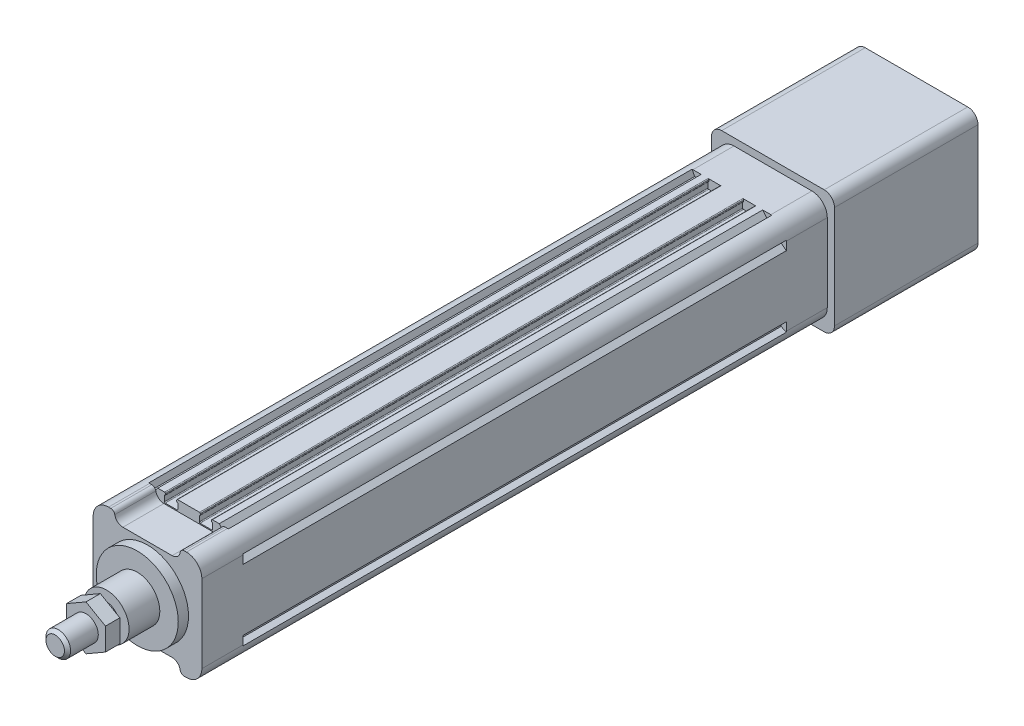
from build123d import *

# Parameters (mm, degrees)
SKETCH_1_R             = 2.1
EXTRUDE_1_DEPTH        = 265
EXTRUDE_2_DEPTH        = 20
SKETCH_7_R             = 20
EXTRUDE_3_DEPTH        = 5
SKETCH_9_R             = 11
EXTRUDE_4_DEPTH        = 15
SKETCH_10_R            = 6
EXTRUDE_5_DEPTH        = 25
EXTRUDE_START          = 20
EXTRUDE_6_DEPTH        = 20
EXTRUDE_7_DEPTH        = 70
SKETCH_14_R            = 19
CUT_EXTRUDE_2_DEPTH    = 70
HOLE_WIZARD_M6_1_D     = 5
HOLE_WIZARD_M6_1_DEPTH = 15
HOLE_WIZARD_M6_1_TIP   = 1.502151548
CHAMFER_1_SIZE         = 1.5
EXTRUDE_START_2        = 3
EXTRUDE_8_DEPTH        = 7


with BuildPart() as part:
    # 草图1 → 凸台-拉伸1 (new body)
    with BuildSketch(Plane.XY):
        with BuildLine():
            Line((-18.2, 24), (-19.443439638, 26.486879276))
            ThreePointArc((-19.443439638, 26.486879276), (-24.303300859, 24.303300859), (-26.486879276, 19.443439638))
            Line((-26.486879276, 19.443439638), (-24, 18.2))
            Line((-24, 18.2), (-24, 17.1))
            Line((-24, 17.1), (-26.5, 15))
            Line((-26.5, 15), (-26.5, -15))
            Line((-26.5, -15), (-24, -17.1))
            Line((-24, -17.1), (-24, -18.2))
            Line((-24, -18.2), (-26.486879276, -19.443439638))
            ThreePointArc((-26.486879276, -19.443439638), (-24.303300859, -24.303300859), (-19.443439638, -26.486879276))
            Line((-19.443439638, -26.486879276), (-18.2, -24))
            Line((-18.2, -24), (-17.1, -24))
            Line((-17.1, -24), (-15, -26.5))
            Line((-15, -26.5), (-11.65, -26.5))
            ThreePointArc((-11.65, -26.5), (-11.367157288, -26.382842712), (-11.25, -26.1))
            Line((-11.25, -26.1), (-11.25, -25.6))
            ThreePointArc((-11.25, -25.6), (-11.367157288, -25.317157288), (-11.65, -25.2))
            Line((-11.65, -25.2), (-11.75, -25.2))
            Line((-11.75, -25.2), (-11.75, -22.4))
            ThreePointArc((-11.75, -22.4), (-11.632842712, -22.117157288), (-11.35, -22))
            Line((-11.35, -22), (-5.65, -22))
            ThreePointArc((-5.65, -22), (-5.367157288, -22.117157288), (-5.25, -22.4))
            Line((-5.25, -22.4), (-5.25, -25.2))
            Line((-5.25, -25.2), (-5.35, -25.2))
            ThreePointArc((-5.35, -25.2), (-5.632842712, -25.317157288), (-5.75, -25.6))
            Line((-5.75, -25.6), (-5.75, -26.1))
            ThreePointArc((-5.75, -26.1), (-5.632842712, -26.382842712), (-5.35, -26.5))
            Line((-5.35, -26.5), (5.35, -26.5))
            ThreePointArc((5.35, -26.5), (5.632842712, -26.382842712), (5.75, -26.1))
            Line((5.75, -26.1), (5.75, -25.6))
            ThreePointArc((5.75, -25.6), (5.632842712, -25.317157288), (5.35, -25.2))
            Line((5.35, -25.2), (5.25, -25.2))
            Line((5.25, -25.2), (5.25, -22.4))
            ThreePointArc((5.25, -22.4), (5.367157288, -22.117157288), (5.65, -22))
            Line((5.65, -22), (11.35, -22))
            ThreePointArc((11.35, -22), (11.632842712, -22.117157288), (11.75, -22.4))
            Line((11.75, -22.4), (11.75, -25.2))
            Line((11.75, -25.2), (11.65, -25.2))
            ThreePointArc((11.65, -25.2), (11.367157288, -25.317157288), (11.25, -25.6))
            Line((11.25, -25.6), (11.25, -26.1))
            ThreePointArc((11.25, -26.1), (11.367157288, -26.382842712), (11.65, -26.5))
            Line((11.65, -26.5), (15, -26.5))
            Line((15, -26.5), (17.1, -24))
            Line((17.1, -24), (18.2, -24))
            Line((18.2, -24), (19.443439638, -26.486879276))
            ThreePointArc((19.443439638, -26.486879276), (24.303300859, -24.303300859), (26.486879276, -19.443439638))
            Line((26.486879276, -19.443439638), (24, -18.2))
            Line((24, -18.2), (24, -17.1))
            Line((24, -17.1), (26.5, -15))
            Line((26.5, -15), (26.5, 15))
            Line((26.5, 15), (24, 17.1))
            Line((24, 17.1), (24, 18.2))
            Line((24, 18.2), (26.486879276, 19.443439638))
            ThreePointArc((26.486879276, 19.443439638), (24.303300859, 24.303300859), (19.443439638, 26.486879276))
            Line((19.443439638, 26.486879276), (18.2, 24))
            Line((18.2, 24), (17.1, 24))
            Line((17.1, 24), (15, 26.5))
            Line((15, 26.5), (11.65, 26.5))
            ThreePointArc((11.65, 26.5), (11.367157288, 26.382842712), (11.25, 26.1))
            Line((11.25, 26.1), (11.25, 25.6))
            ThreePointArc((11.25, 25.6), (11.367157288, 25.317157288), (11.65, 25.2))
            Line((11.65, 25.2), (11.75, 25.2))
            Line((11.75, 25.2), (11.75, 22.4))
            ThreePointArc((11.75, 22.4), (11.632842712, 22.117157288), (11.35, 22))
            Line((11.35, 22), (5.65, 22))
            ThreePointArc((5.65, 22), (5.367157288, 22.117157288), (5.25, 22.4))
            Line((5.25, 22.4), (5.25, 25.2))
            Line((5.25, 25.2), (5.35, 25.2))
            ThreePointArc((5.35, 25.2), (5.632842712, 25.317157288), (5.75, 25.6))
            Line((5.75, 25.6), (5.75, 26.1))
            ThreePointArc((5.75, 26.1), (5.632842712, 26.382842712), (5.35, 26.5))
            Line((5.35, 26.5), (-5.35, 26.5))
            ThreePointArc((-5.35, 26.5), (-5.632842712, 26.382842712), (-5.75, 26.1))
            Line((-5.75, 26.1), (-5.75, 25.6))
            ThreePointArc((-5.75, 25.6), (-5.632842712, 25.317157288), (-5.35, 25.2))
            Line((-5.35, 25.2), (-5.25, 25.2))
            Line((-5.25, 25.2), (-5.25, 22.4))
            ThreePointArc((-5.25, 22.4), (-5.367157288, 22.117157288), (-5.65, 22))
            Line((-5.65, 22), (-11.35, 22))
            ThreePointArc((-11.35, 22), (-11.632842712, 22.117157288), (-11.75, 22.4))
            Line((-11.75, 22.4), (-11.75, 25.2))
            Line((-11.75, 25.2), (-11.65, 25.2))
            ThreePointArc((-11.65, 25.2), (-11.367157288, 25.317157288), (-11.25, 25.6))
            Line((-11.25, 25.6), (-11.25, 26.1))
            ThreePointArc((-11.25, 26.1), (-11.367157288, 26.382842712), (-11.65, 26.5))
            Line((-11.65, 26.5), (-15, 26.5))
            Line((-15, 26.5), (-17.1, 24))
            Line((-17.1, 24), (-18.2, 24))
        make_face()
        with Locations((19, 19)):
            Circle(SKETCH_1_R, mode=Mode.SUBTRACT)
        with Locations((19, -19)):
            Circle(SKETCH_1_R, mode=Mode.SUBTRACT)
        with Locations((-19, -19)):
            Circle(SKETCH_1_R, mode=Mode.SUBTRACT)
        with Locations((-19, 19)):
            Circle(SKETCH_1_R, mode=Mode.SUBTRACT)
        with BuildLine():
            Line((19.773719933, 3), (23.3, 3))
            Line((23.3, 3), (23.3, -3))
            Line((23.3, -3), (19.773719933, -3))
            ThreePointArc((19.773719933, -3), (0, -20), (-19.773719933, -3))
            Line((-19.773719933, -3), (-23.3, -3))
            Line((-23.3, -3), (-23.3, 3))
            Line((-23.3, 3), (-19.773719933, 3))
            ThreePointArc((-19.773719933, 3), (0, 20), (19.773719933, 3))
        make_face(mode=Mode.SUBTRACT)
    extrude(amount=EXTRUDE_1_DEPTH)

    # 草图6 → 凸台-拉伸2 (add)
    with BuildSketch(Plane.XY.offset(265)):
        with BuildLine():
            Line((-26.5, -19), (-26.5, 19))
            ThreePointArc((-26.5, 19), (-24.303300859, 24.303300859), (-19, 26.5))
            Line((-19, 26.5), (-17.916079783, 26.5))
            ThreePointArc((-17.916079783, 26.5), (-16.625085334, 26.027525232), (-15.944053189, 24.833333333))
            ThreePointArc((-15.944053189, 24.833333333), (-14.581988897, 22.444949537), (-12, 21.5))
            Line((-12, 21.5), (12, 21.5))
            ThreePointArc((12, 21.5), (14.581988897, 22.444949537), (15.944053189, 24.833333333))
            ThreePointArc((15.944053189, 24.833333333), (16.625085334, 26.027525232), (17.916079783, 26.5))
            Line((17.916079783, 26.5), (19, 26.5))
            ThreePointArc((19, 26.5), (24.303300859, 24.303300859), (26.5, 19))
            Line((26.5, 19), (26.5, -19))
            ThreePointArc((26.5, -19), (24.303300859, -24.303300859), (19, -26.5))
            Line((19, -26.5), (17.916079783, -26.5))
            ThreePointArc((17.916079783, -26.5), (16.625085334, -26.027525232), (15.944053189, -24.833333333))
            ThreePointArc((15.944053189, -24.833333333), (14.581988897, -22.444949537), (12, -21.5))
            Line((12, -21.5), (-12, -21.5))
            ThreePointArc((-12, -21.5), (-14.581988897, -22.444949537), (-15.944053189, -24.833333333))
            ThreePointArc((-15.944053189, -24.833333333), (-16.625085334, -26.027525232), (-17.916079783, -26.5))
            Line((-17.916079783, -26.5), (-19, -26.5))
            ThreePointArc((-19, -26.5), (-24.303300859, -24.303300859), (-26.5, -19))
        make_face()
    extrude(amount=EXTRUDE_2_DEPTH)

    # 草图7 → 凸台-拉伸3 (add)
    with BuildSketch(Plane.XY.offset(285)):
        Circle(SKETCH_7_R)
    extrude(amount=EXTRUDE_3_DEPTH)

    # 草图9 → 凸台-拉伸4 (add)
    with BuildSketch(Plane.XY.offset(290)):
        Circle(SKETCH_9_R)
    extrude(amount=EXTRUDE_4_DEPTH)

    # 草图10 → 凸台-拉伸5 (add)
    with BuildSketch(Plane.XY.offset(305)):
        Circle(SKETCH_10_R)
    extrude(amount=EXTRUDE_5_DEPTH)

    # 草图11 → 凸台-拉伸6 (add)
    with BuildSketch(Plane(origin=(0, 0, 0), x_dir=(-1, 0, 0), z_dir=(0, 0, -1)).offset(EXTRUDE_START)):
        with BuildLine():
            Line((-19, -26.5), (19, -26.5))
            ThreePointArc((19, -26.5), (24.303300859, -24.303300859), (26.5, -19))
            Line((26.5, -19), (26.5, 19))
            ThreePointArc((26.5, 19), (24.303300859, 24.303300859), (19, 26.5))
            Line((19, 26.5), (-19, 26.5))
            ThreePointArc((-19, 26.5), (-24.303300859, 24.303300859), (-26.5, 19))
            Line((-26.5, 19), (-26.5, -19))
            ThreePointArc((-26.5, -19), (-24.303300859, -24.303300859), (-19, -26.5))
        make_face()
    extrude(amount=-EXTRUDE_6_DEPTH)

    # 草图12 → 凸台-拉伸7 (add)
    with BuildSketch(Plane(origin=(0, 0, -20), x_dir=(-1, 0, 0), z_dir=(0, 0, -1))):
        with BuildLine():
            Line((-25, -30), (25, -30))
            ThreePointArc((25, -30), (28.535533906, -28.535533906), (30, -25))
            Line((30, -25), (30, 25))
            ThreePointArc((30, 25), (28.535533906, 28.535533906), (25, 30))
            Line((25, 30), (-25, 30))
            ThreePointArc((-25, 30), (-28.535533906, 28.535533906), (-30, 25))
            Line((-30, 25), (-30, -25))
            ThreePointArc((-30, -25), (-28.535533906, -28.535533906), (-25, -30))
        make_face()
    extrude(amount=EXTRUDE_7_DEPTH)

    # 草图14 → 切除-拉伸2 (cut)
    with BuildSketch(Plane(origin=(0, 0, -90), x_dir=(-1, 0, 0), z_dir=(0, 0, -1))):
        Circle(SKETCH_14_R)
    extrude(amount=-CUT_EXTRUDE_2_DEPTH, mode=Mode.SUBTRACT)

    # M6 螺纹孔1
    with Locations(Plane.ZY.offset(26.5)):
        with Locations((275, 11), (275, -11), (-10, 11), (-10, -11)):
            Hole(HOLE_WIZARD_M6_1_D / 2, depth=HOLE_WIZARD_M6_1_DEPTH)
            with Locations((0, 0, -(HOLE_WIZARD_M6_1_DEPTH + HOLE_WIZARD_M6_1_TIP / 2))):  # 118° drill point
                Cone(0, HOLE_WIZARD_M6_1_D / 2, HOLE_WIZARD_M6_1_TIP, mode=Mode.SUBTRACT)

    # 倒角1
    chamfer_1_edges = [part.edges().sort_by_distance(p)[0] for p in [
        (-6, 0, 330),
    ]]
    chamfer(chamfer_1_edges, length=CHAMFER_1_SIZE)

    # 草图17 → 凸台-拉伸8 (add)
    with BuildSketch(Plane.XY.offset(305).offset(EXTRUDE_START_2)):
        Polygon((0, 10.969655115), (-9.5, 5.484827557), (-9.5, -5.484827557), (0, -10.969655115), (9.5, -5.484827557), (9.5, 5.484827557), align=None)
    extrude(amount=EXTRUDE_8_DEPTH)


solid = part.part
